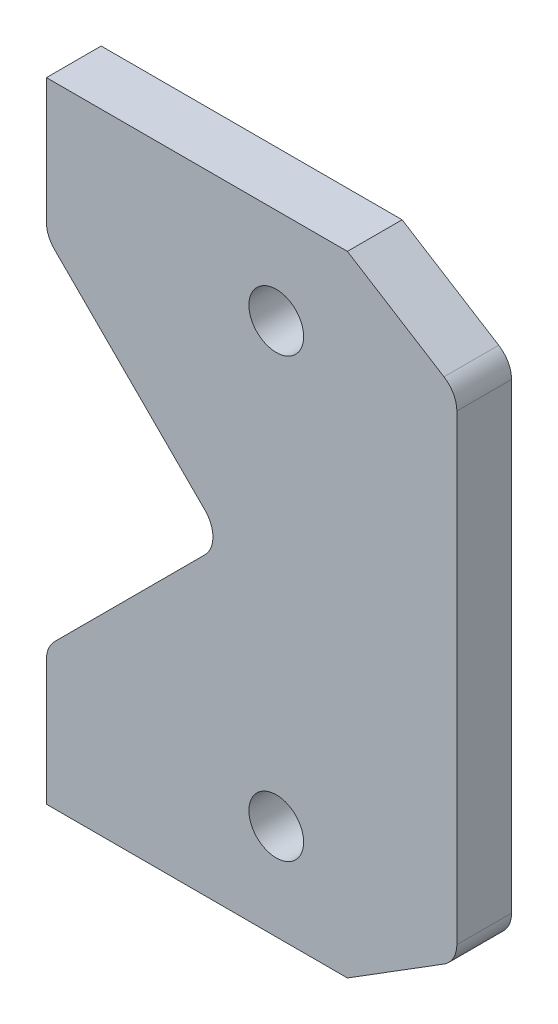
from build123d import *

# Parameters (mm, degrees)
EXTRUDE_1_DEPTH     = 10
FILLET_1_R          = 5
SKETCH_2_W          = 14.503098638
SKETCH_2_H          = 45
EXTRUDE_4_DEPTH     = 10
FILLET_3_R          = 5
SKETCH_3_R          = 5
CUT_EXTRUDE_2_DEPTH = 82.929848041
FILLET_4_R          = 5
SKETCH_4_R          = 5
CUT_EXTRUDE_5_DEPTH = 70.372184628
EXTRUDE_7_DEPTH     = 10


with BuildPart() as part:
    # 草图1 → 凸台-拉伸1 (new body)
    with BuildSketch(Plane.XY):
        Polygon((37.5, 57.5), (-37.5, 57.5), (-37.5, 32.5), (-5, 0), (-37.5, -32.5), (-37.5, -57.5), (37.5, -57.5), align=None)
    extrude(amount=EXTRUDE_1_DEPTH)

    # 圆角1
    fillet_1_edges = [part.edges().sort_by_distance(p)[0] for p in [
        (-5, 0, 5),
        (-37.5, 32.5, 5),
        (-37.5, -32.5, 5),
    ]]
    fillet(fillet_1_edges, radius=FILLET_1_R)

    # 草图2 → 凸台-拉伸4 (add)
    with BuildSketch(Plane.XY.offset(10)):
        Polygon((37.5, 57.5), (37.5, 0), (42.996901362, 0), (42.996901362, 45), (57.5, 45), align=None)
        with Locations((50.248450681, 22.5)):
            Rectangle(SKETCH_2_W, SKETCH_2_H)
        with Locations((50.248450681, -22.5)):
            Rectangle(SKETCH_2_W, SKETCH_2_H)
        Polygon((37.5, 0), (37.5, -57.5), (57.5, -45), (42.996901362, -45), (42.996901362, 0), align=None)
    extrude(amount=-EXTRUDE_4_DEPTH)

    # 圆角3
    fillet_3_edges = [part.edges().sort_by_distance(p)[0] for p in [
        (57.5, -45, 5),
        (57.5, 45, 5),
    ]]
    fillet(fillet_3_edges, radius=FILLET_3_R)

    # 草图3 → 切除-拉伸2 (cut, through all)
    with BuildSketch(Plane.XY.offset(10)):
        Polygon((17.5, 57.5), (37.5, 45), (37.5, 57.5), align=None)
        with BuildLine():
            Line((37.5, 57.5), (37.5, -57.5))
            Line((37.5, -57.5), (55.1499947, -46.468753312))
            ThreePointArc((55.1499947, -46.468753312), (56.873212406, -44.652604454), (57.5, -42.228761792))
            Line((57.5, -42.228761792), (57.5, 42.228761792))
            ThreePointArc((57.5, 42.228761792), (56.873212406, 44.652604454), (55.1499947, 46.468753312))
            Line((55.1499947, 46.468753312), (37.5, 57.5))
        make_face()
        Polygon((37.5, -45), (17.5, -57.5), (37.5, -57.5), align=None)
        with Locations((4.5, -32.5)):
            Circle(SKETCH_3_R)
        with Locations((4.5, 32.5)):
            Circle(SKETCH_3_R)
    extrude(amount=-CUT_EXTRUDE_2_DEPTH, mode=Mode.SUBTRACT)

    # 圆角4
    fillet_4_edges = [part.edges().sort_by_distance(p)[0] for p in [
        (37.5, -45, 5),
        (37.5, 45, 5),
    ]]
    fillet(fillet_4_edges, radius=FILLET_4_R)

    # 草图4 → 切除-拉伸5 (cut, through all)
    with BuildSketch(Plane.XY.offset(10)):
        with Locations((4.5, 40)):
            Circle(SKETCH_4_R)
        with Locations((4.5, 32.5)):
            Circle(SKETCH_4_R)
        with Locations((4.5, -40)):
            Circle(SKETCH_4_R)
        with Locations((4.5, -32.5)):
            Circle(SKETCH_4_R)
    extrude(amount=-CUT_EXTRUDE_5_DEPTH, mode=Mode.SUBTRACT)

    # 草图7 → 凸台-拉伸7 (add)
    with BuildSketch(Plane.XY.offset(10)):
        with BuildLine():
            ThreePointArc((1.192810861, 36.25), (2.442810861, 27.942810861), (9.5, 32.5))
            ThreePointArc((9.5, 32.5), (9.057189139, 34.557189139), (7.807189139, 36.25))
            ThreePointArc((7.807189139, 36.25), (4.5, 35), (1.192810861, 36.25))
        make_face()
        with BuildLine():
            ThreePointArc((7.807189139, -36.25), (9.057189139, -34.557189139), (9.5, -32.5))
            ThreePointArc((9.5, -32.5), (2.442810861, -27.942810861), (1.192810861, -36.25))
            ThreePointArc((1.192810861, -36.25), (4.5, -35), (7.807189139, -36.25))
        make_face()
    extrude(amount=-EXTRUDE_7_DEPTH)


solid = part.part
